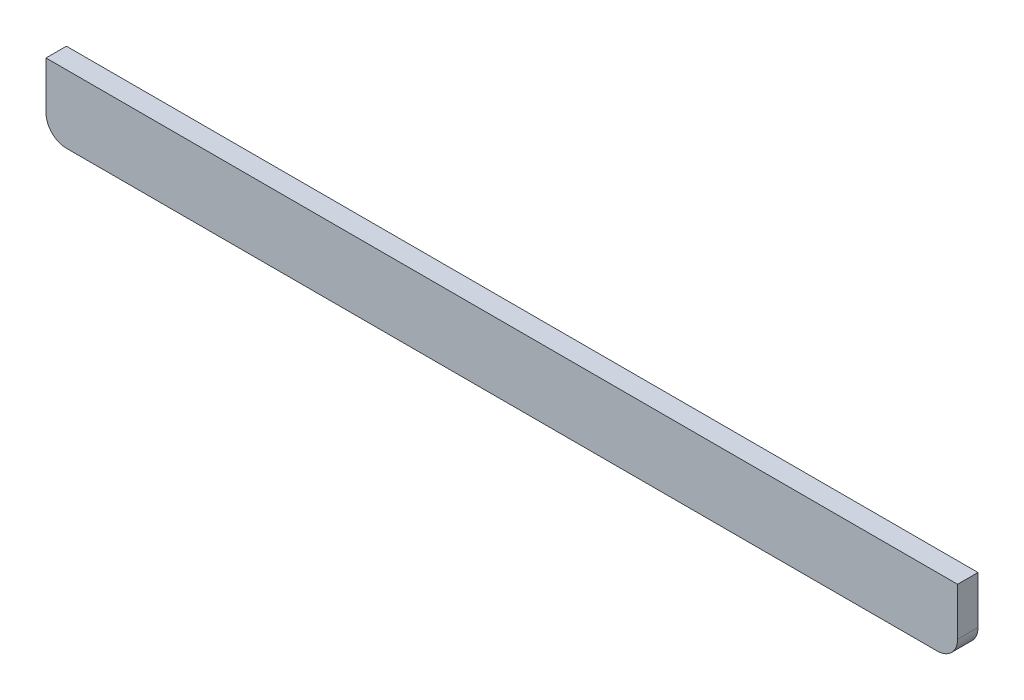
from build123d import *

# Parameters (mm, degrees)
SKETCH2_W           = 134
SKETCH2_H           = 10
BOSS_EXTRUDE1_DEPTH = 3
FILLET1_R           = 3


with BuildPart() as part:
    # Sketch2 → Boss-Extrude1 (new body)
    with BuildSketch(Plane.XY):
        with Locations((67, 5)):
            Rectangle(SKETCH2_W, SKETCH2_H)
    extrude(amount=BOSS_EXTRUDE1_DEPTH)

    # Fillet1
    fillet1_edges = [part.edges().sort_by_distance(p)[0] for p in [
        (0, 0, 1.5),
        (134, 0, 1.5),
    ]]
    fillet(fillet1_edges, radius=FILLET1_R)


solid = part.part
